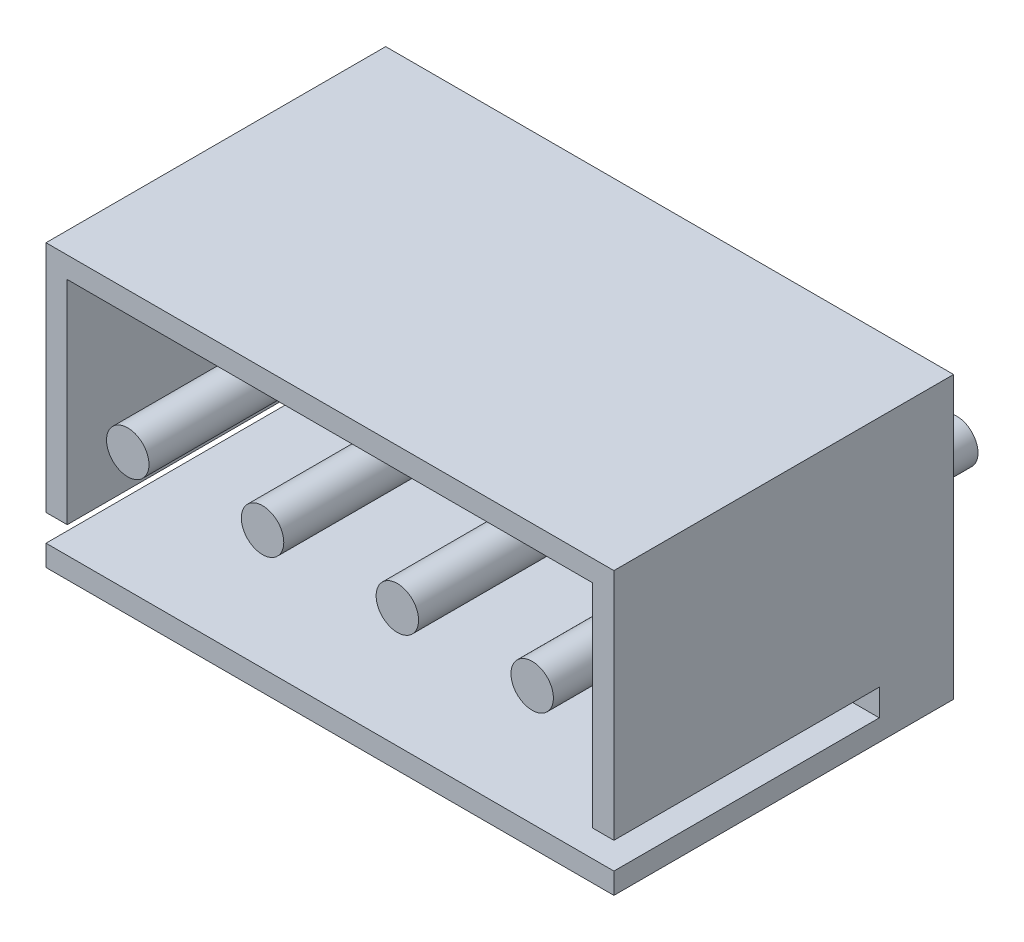
from build123d import *

# Parameters (mm, degrees)
SKETCH_1_W          = 10.7
SKETCH_1_H          = 5.3
EXTRUDE_1_DEPTH     = 6.4
SKETCH_2_W          = 9.9
SKETCH_2_H          = 4.5
SKETCH_2_R          = 0.4
CUT_EXTRUDE_1_DEPTH = 5
SKETCH_3_W          = 12.899416502
SKETCH_3_H          = 0.501475964
CUT_EXTRUDE_2_DEPTH = 5
SKETCH_4_R          = 0.4
EXTRUDE_2_DEPTH     = 8


with BuildPart() as part:
    # Эскиз1 → Вытянуть1 (new body)
    with BuildSketch(Plane.XY):
        Rectangle(SKETCH_1_W, SKETCH_1_H)
    extrude(amount=EXTRUDE_1_DEPTH)

    # Эскиз2 → Вырез-Вытянуть1 (cut)
    with BuildSketch(Plane.XY.offset(6.4)):
        Rectangle(SKETCH_2_W, SKETCH_2_H)
        with Locations((-1.27, 0)):
            Circle(SKETCH_2_R, mode=Mode.SUBTRACT)
        with Locations((1.27, 0)):
            Circle(SKETCH_2_R, mode=Mode.SUBTRACT)
        with Locations((-3.81, 0)):
            Circle(SKETCH_2_R, mode=Mode.SUBTRACT)
        with Locations(Location((3.81, 0, 0), (0, 0, 180))):
            Circle(SKETCH_2_R, mode=Mode.SUBTRACT)
    extrude(amount=-CUT_EXTRUDE_1_DEPTH, mode=Mode.SUBTRACT)

    # Эскиз3 → Вырез-Вытянуть2 (cut)
    with BuildSketch(Plane.XY.offset(6.4)):
        with Locations((-0.066925705, -2.002104797)):
            Rectangle(SKETCH_3_W, SKETCH_3_H)
    extrude(amount=-CUT_EXTRUDE_2_DEPTH, mode=Mode.SUBTRACT)

    # Эскиз4 → Вытянуть2 (add)
    with BuildSketch(Plane.XY.offset(6.4)):
        with Locations((-1.27, 0)):
            Circle(SKETCH_4_R)
        with Locations((1.27, 0)):
            Circle(SKETCH_4_R)
        with Locations((-3.81, 0)):
            Circle(SKETCH_4_R)
        with Locations(Location((3.81, 0, 0), (0, 0, 180))):
            Circle(SKETCH_4_R)
    extrude(amount=-EXTRUDE_2_DEPTH)


solid = part.part
